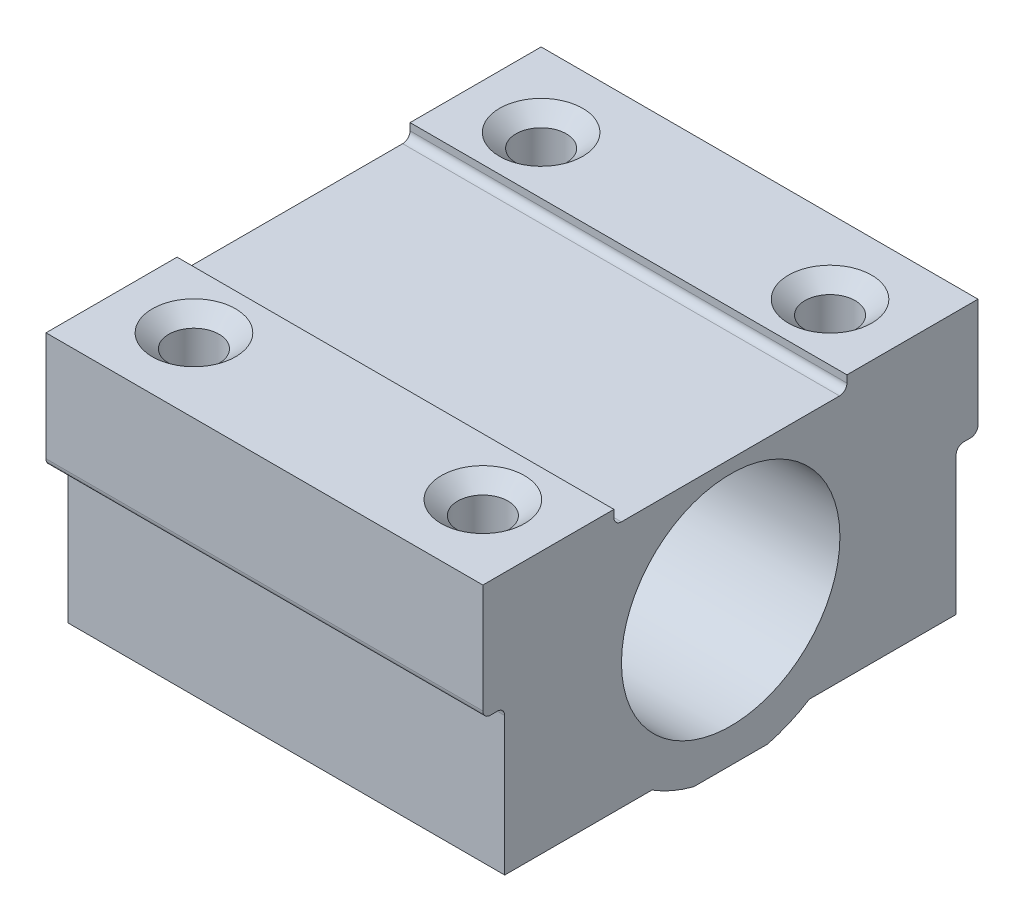
from build123d import *

# Parameters (mm, degrees)
SKETCH1_R                                         = 7.5
BOSS_EXTRUDE1_DEPTH                               = 30
CSK_FOR_4_FLAT_HEAD_MACHINE_SCREW_100_D           = 3.4544
CSK_FOR_4_FLAT_HEAD_MACHINE_SCREW_100_DEPTH       = 6.35
CSK_FOR_4_FLAT_HEAD_MACHINE_SCREW_100_CSINK_D     = 5.715
CSK_FOR_4_FLAT_HEAD_MACHINE_SCREW_100_CSINK_ANGLE = 100
CSK_FOR_4_FLAT_HEAD_MACHINE_SCREW_100_TIP         = 1.037806461
FILLET1_R                                         = 0.508


with BuildPart() as part:
    # Sketch1 → Boss-Extrude1 (new body)
    with BuildSketch(Plane(origin=(0, 0, 0), x_dir=(0, 0, -1), z_dir=(1, 0, 0))):
        with BuildLine():
            Line((32.5, 0), (34, 0))
            Line((34, 0), (34, 7.49375))
            Line((34, 7.49375), (34, 8))
            Line((34, 8), (25, 8))
            Line((25, 8), (25, 7))
            Line((25, 7), (9, 7))
            Line((9, 7), (9, 8))
            Line((9, 8), (0, 8))
            Line((0, 8), (0, 7.49375))
            Line((0, 7.49375), (0, 0))
            Line((0, 0), (1.5, 0))
            Line((1.5, 0), (1.5, -10))
            Line((1.5, -10), (11.611411797, -10))
            ThreePointArc((11.611411797, -10), (13.001010498, -10.730169916), (14.486500092, -11.237568497))
            Line((14.486500092, -11.237568497), (19.549499908, -11.237568497))
            ThreePointArc((19.549499908, -11.237568497), (21.034989502, -10.730169916), (22.424588203, -10))
            Line((22.424588203, -10), (32.5, -10))
            Line((32.5, -10), (32.5, 0))
        make_face()
        with Locations((17.018, -1.398)):
            Circle(SKETCH1_R, mode=Mode.SUBTRACT)
    extrude(amount=BOSS_EXTRUDE1_DEPTH)

    # CSK for #4 Flat Head Machine Screw (100)1
    with Locations(Plane(origin=(0, 8, 0), x_dir=(1, 0, 0), z_dir=(0, 1, 0))):
        with Locations((5.08, 28.92), (24.92, 28.92), (24.92, 5.08), (5.08, 5.08)):
            CounterSinkHole(CSK_FOR_4_FLAT_HEAD_MACHINE_SCREW_100_D / 2, CSK_FOR_4_FLAT_HEAD_MACHINE_SCREW_100_CSINK_D / 2, depth=CSK_FOR_4_FLAT_HEAD_MACHINE_SCREW_100_DEPTH, counter_sink_angle=CSK_FOR_4_FLAT_HEAD_MACHINE_SCREW_100_CSINK_ANGLE)
            with Locations((0, 0, -(CSK_FOR_4_FLAT_HEAD_MACHINE_SCREW_100_DEPTH + CSK_FOR_4_FLAT_HEAD_MACHINE_SCREW_100_TIP / 2))):  # 118° drill point
                Cone(0, CSK_FOR_4_FLAT_HEAD_MACHINE_SCREW_100_D / 2, CSK_FOR_4_FLAT_HEAD_MACHINE_SCREW_100_TIP, mode=Mode.SUBTRACT)

    # Fillet1
    fillet1_edges = [part.edges().sort_by_distance(p)[0] for p in [
        (15, 7, -9),
        (15, 7, -25),
        (15, 0, -34),
        (15, 0, -32.5),
        (15, 0, -1.5),
        (15, 0, 0),
    ]]
    fillet(fillet1_edges, radius=FILLET1_R)


solid = part.part
